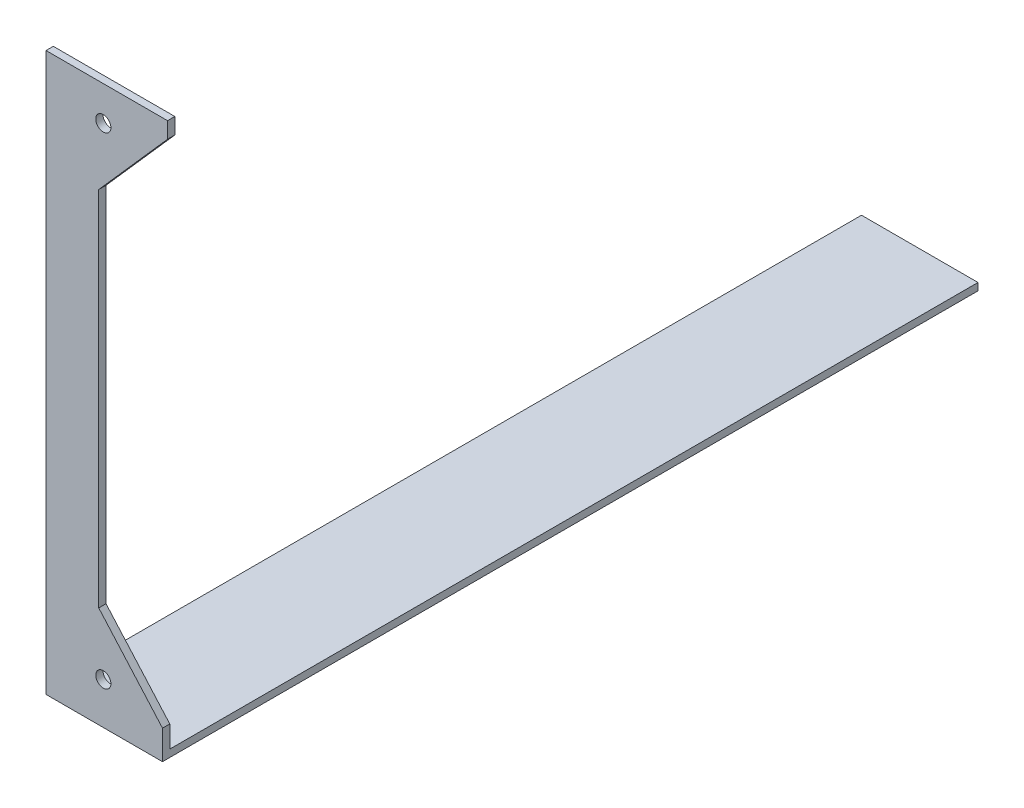
from build123d import *

# Parameters (mm, degrees)
SKETCH1_R           = 1.65
BOSS_EXTRUDE1_DEPTH = 1.5875
SKETCH2_W           = 25.4
SKETCH2_H           = 177.8
BOSS_EXTRUDE2_DEPTH = 1.5875


with BuildPart() as part:
    # Sketch1 → Boss-Extrude1 (new body)
    with BuildSketch(Plane.XY):
        Polygon((-223.5, 120), (-250, 120), (-250, 0), (-224.6, 0), (-224.6, 4.746666667), (-238.5, 20.5), (-238.5, 99.5), (-223.5, 116.5), align=None)
        with Locations((-237.5, 7.5)):
            Circle(SKETCH1_R, mode=Mode.SUBTRACT)
        with Locations((-237.5, 112.5)):
            Circle(SKETCH1_R, mode=Mode.SUBTRACT)
    extrude(amount=BOSS_EXTRUDE1_DEPTH)

    # Sketch2 → Boss-Extrude2 (add)
    with BuildSketch(Plane(origin=(0, 0, 0), x_dir=(1, 0, 0), z_dir=(0, 1, 0))):
        with Locations((-237.3, 87.3125)):
            Rectangle(SKETCH2_W, SKETCH2_H)
    extrude(amount=-BOSS_EXTRUDE2_DEPTH)


solid = part.part
